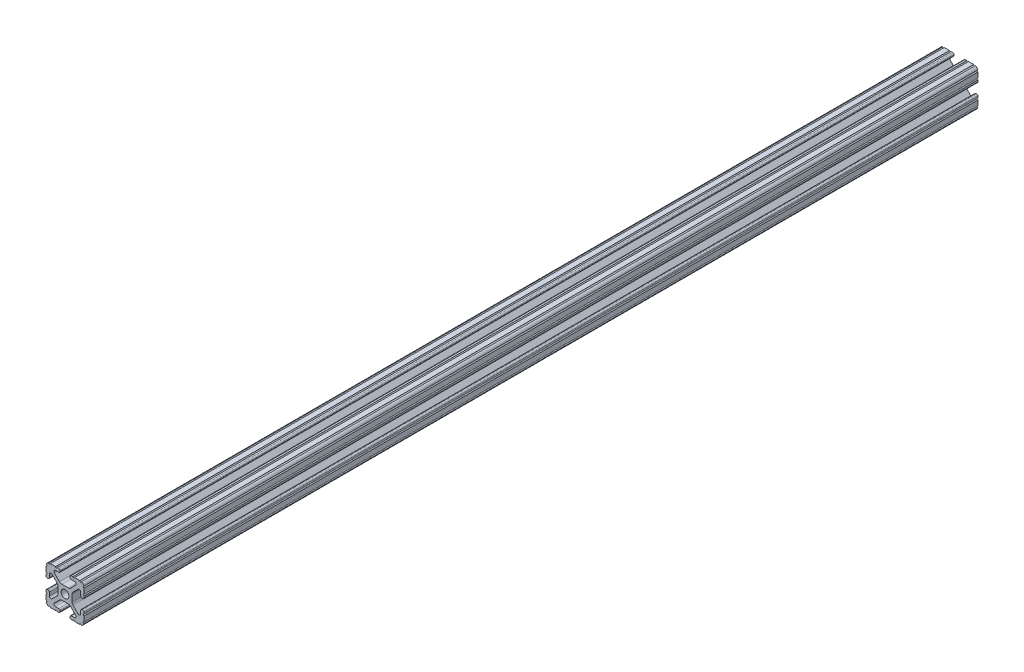
from build123d import *

# Parameters (mm, degrees)
BOSS_EXTRUDE1_DEPTH     = 1524
CUT_EXTRUDE1_DEPTH      = 1525.105829659
CUT_EXTRUDE1_DEPTH_BACK = 1525.105829659
SKETCH5_R               = 0.55245
CUT_EXTRUDE2_DEPTH      = 1525.105829659
CUT_EXTRUDE2_DEPTH_BACK = 1525.105829659
SKETCH8_W               = 50.559993734
SKETCH8_H               = 1231.9
CUT_EXTRUDE3_DEPTH      = 1525.105829659
CUT_EXTRUDE3_DEPTH_BACK = 1525.105829659
SKETCH9_W               = 50.679996867
SKETCH9_H               = 1244.6


with BuildPart() as part:
    # Sketch4 → Boss-Extrude1 (new, symmetric)
    with BuildSketch(Plane.XY):
        with BuildLine():
            Line((4.190365, -12.7), (10.11729625, -12.7))
            ThreePointArc((10.11729625, -12.7), (11.943543585, -11.943543585), (12.7, -10.11729625))
            Line((12.7, -10.11729625), (12.7, -4.190365))
            ThreePointArc((12.7, -4.190365), (12.42492494, -3.52627506), (11.760835, -3.2512))
            Line((11.760835, -3.2512), (11.429365, -3.2512))
            ThreePointArc((11.429365, -3.2512), (10.76527506, -3.52627506), (10.4902, -4.190365))
            Line((10.4902, -4.190365), (10.4902, -6.348478019))
            ThreePointArc((10.4902, -6.348478019), (9.830707141, -7.335478831), (8.666460301, -7.103895736))
            Line((8.666460301, -7.103895736), (5.299899128, -3.737334563))
            ThreePointArc((5.299899128, -3.737334563), (4.817571085, -3.015479634), (4.6482, -2.16399369))
            Line((4.6482, -2.16399369), (4.6482, 0))
            Line((4.6482, 0), (2.6035, 0))
            ThreePointArc((2.6035, 0), (1.840952505, -1.840952505), (0, -2.6035))
            Line((0, -2.6035), (0, -4.6482))
            Line((0, -4.6482), (2.16399369, -4.6482))
            ThreePointArc((2.16399369, -4.6482), (3.015479634, -4.817571085), (3.737334563, -5.299899128))
            Line((3.737334563, -5.299899128), (7.103895736, -8.666460301))
            ThreePointArc((7.103895736, -8.666460301), (7.335478831, -9.830707141), (6.348478019, -10.4902))
            Line((6.348478019, -10.4902), (4.190365, -10.4902))
            ThreePointArc((4.190365, -10.4902), (3.52627506, -10.76527506), (3.2512, -11.429365))
            Line((3.2512, -11.429365), (3.2512, -11.760835))
            ThreePointArc((3.2512, -11.760835), (3.52627506, -12.42492494), (4.190365, -12.7))
        make_face()
    extrude(amount=BOSS_EXTRUDE1_DEPTH, both=True)

    # Sketch5 → Cut-Extrude1 (cut, two sides: drawn at the far end of the back side and taken through both)
    with BuildSketch(Plane.XY.offset(-CUT_EXTRUDE1_DEPTH_BACK)):
        with Locations((10.356153152, -12.7)):
            Circle(SKETCH5_R)
        with Locations((5.796028019, -12.7)):
            Circle(SKETCH5_R)
        with Locations((12.7, -10.356153152)):
            Circle(SKETCH5_R)
        with Locations((12.7, -5.796028019)):
            Circle(SKETCH5_R)
    extrude(amount=CUT_EXTRUDE1_DEPTH + CUT_EXTRUDE1_DEPTH_BACK, mode=Mode.SUBTRACT)

    # Mirror1: part across plane


with BuildPart() as part_1:
    add(part.part)
    add(part.part.mirror(Plane(origin=(0, 0, 0), x_dir=(0, 0, 1), z_dir=(1, 0, 0))))

    # Mirror2: part across plane


with BuildPart() as part_2:
    add(part_1.part)
    add(part_1.part.mirror(Plane.ZX))

    # Sketch8 → Cut-Extrude2 (cut, two sides: drawn at the far end of the back side and taken through both)
    with BuildSketch(Plane(origin=(0, 0, 0), x_dir=(1, 0, 0), z_dir=(0, 1, 0)).offset(-CUT_EXTRUDE2_DEPTH_BACK)):
        with Locations((0, 920.75)):
            Rectangle(SKETCH8_W, SKETCH8_H)
    extrude(amount=CUT_EXTRUDE2_DEPTH + CUT_EXTRUDE2_DEPTH_BACK, mode=Mode.SUBTRACT)

    # Sketch9 → Cut-Extrude3 (cut, two sides: drawn at the far end of the back side and taken through both)
    with BuildSketch(Plane(origin=(0, 0, 0), x_dir=(1, 0, 0), z_dir=(0, 1, 0)).offset(-CUT_EXTRUDE3_DEPTH_BACK)):
        with Locations((-0.060001567, -304.8)):
            Rectangle(SKETCH9_W, SKETCH9_H)
    extrude(amount=CUT_EXTRUDE3_DEPTH + CUT_EXTRUDE3_DEPTH_BACK, mode=Mode.SUBTRACT)


solid = part_2.part
